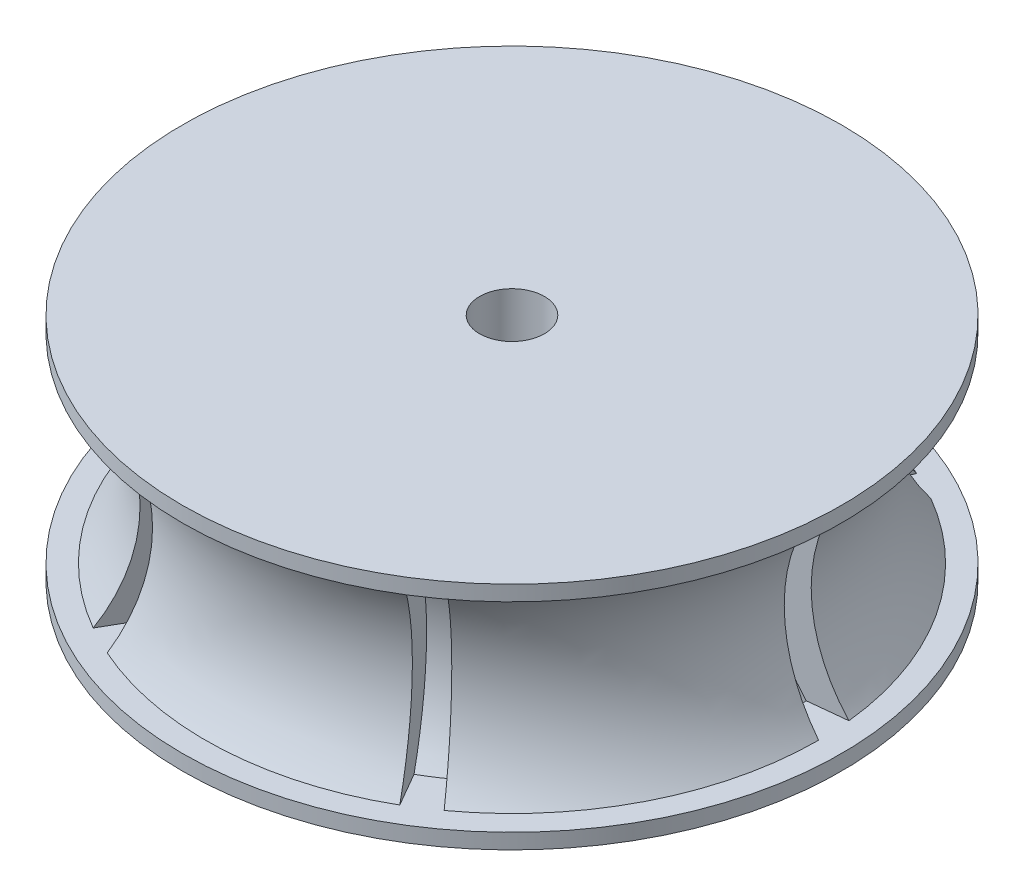
from build123d import *

# Parameters (mm, degrees)
SKETCH3_R          = 6.35
CUT_EXTRUDE1_DEPTH = 102.849420847
CUT_REVOLVE5_ANGLE = 6
CIRPATTERN1_COUNT  = 6


with BuildPart() as part:
    # Sketch1 → Revolve1 (revolve)
    with BuildSketch(Plane(origin=(0, 0, 0), x_dir=(0, 0, -1), z_dir=(1, 0, 0))):
        with BuildLine():
            Line((-60.072805913, 19.55), (-64.572805913, 19.55))
            Line((-64.572805913, 19.55), (-64.572805913, 22.55))
            Line((-64.572805913, 22.55), (0, 22.55))
            Line((0, 22.55), (0, -22.55))
            Line((0, -22.55), (-64.572805913, -22.55))
            Line((-64.572805913, -22.55), (-64.572805913, -19.55))
            Line((-64.572805913, -19.55), (-60.072805913, -19.55))
            ThreePointArc((-60.072805913, -19.55), (-53.34, 0), (-60.072805913, 19.55))
        make_face()
    revolve(axis=Axis((0, 22.55, 0), (0, -1, 0)))

    # Sketch3 → Cut-Extrude1 (cut, through all)
    with BuildSketch(Plane(origin=(0, 22.55, 0), x_dir=(1, 0, 0), z_dir=(0, 1, 0))):
        with Locations(Location((0, 0, 0), (0, 0, 270))):
            Circle(SKETCH3_R)
    extrude(amount=-CUT_EXTRUDE1_DEPTH, mode=Mode.SUBTRACT)

    # Sketch4 → Cut-Revolve5 (revolve, cut)
    with BuildSketch(Plane.XY):
        with BuildLine():
            Line((-60.072805913, 19.55), (-52.452805913, 19.55))
            ThreePointArc((-52.452805913, 19.55), (-45.72, 0), (-52.452805913, -19.55))
            Line((-52.452805913, -19.55), (-60.072805913, -19.55))
            ThreePointArc((-60.072805913, -19.55), (-53.34, 0), (-60.072805913, 19.55))
        make_face()
    cut_revolve5 = revolve(axis=Axis((0, 0, 0), (0, 1, 0)), revolution_arc=CUT_REVOLVE5_ANGLE, mode=Mode.SUBTRACT)

    # CirPattern1: Cut-Revolve5 ×6 about axis
    cirpattern1_axis = Axis((0, 0, 0), (0, 1, 0))
    for i in range(1, CIRPATTERN1_COUNT):
        add(cut_revolve5.rotate(cirpattern1_axis, i * 360 / CIRPATTERN1_COUNT), mode=Mode.SUBTRACT)


solid = part.part
